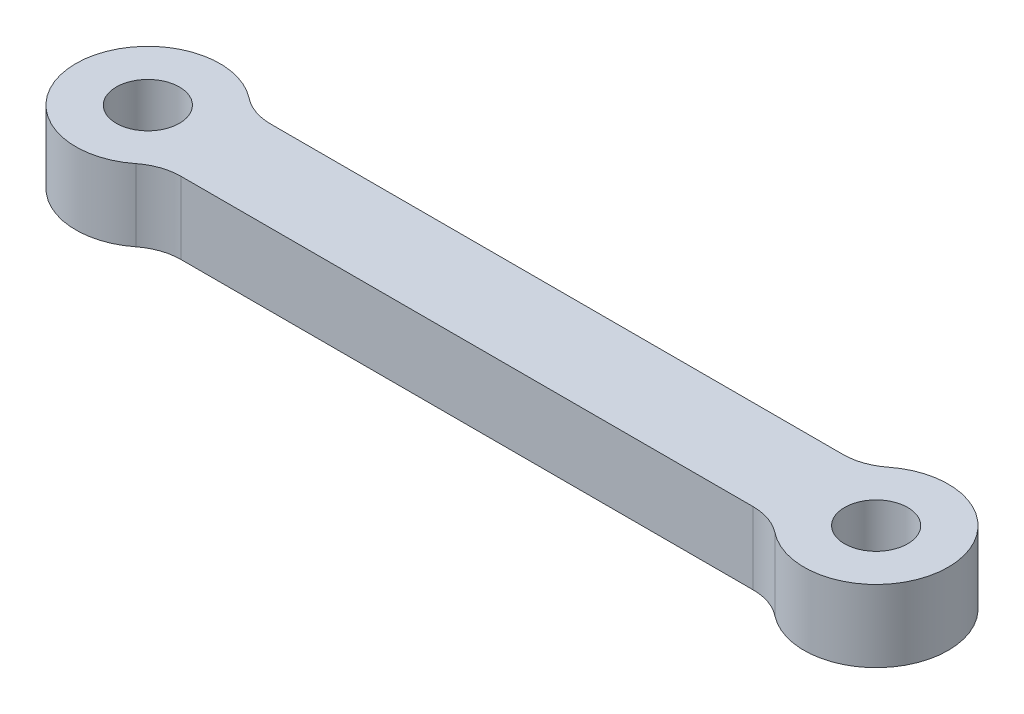
from build123d import *

# Parameters (mm, degrees)
SKETCH1_R           = 1.75
BOSS_EXTRUDE1_DEPTH = 4


with BuildPart() as part:
    # Sketch1 → Boss-Extrude1 (new body)
    with BuildSketch(Plane.XZ):
        with BuildLine():
            Line((36.07987298, 2.5), (4.330127019, 2.5))
            ThreePointArc((4.330127019, 2.5), (3.348146513, 2.665266452), (2.474358297, 3.142857143))
            ThreePointArc((2.474358297, 3.142857143), (-4, 0), (2.474358297, -3.142857143))
            ThreePointArc((2.474358297, -3.142857143), (3.348146513, -2.665266452), (4.330127019, -2.5))
            Line((4.330127019, -2.5), (36.07987298, -2.5))
            ThreePointArc((36.07987298, -2.5), (37.061853486, -2.665266452), (37.935641702, -3.142857143))
            ThreePointArc((37.935641702, -3.142857143), (44.409999999, 0), (37.935641702, 3.142857143))
            ThreePointArc((37.935641702, 3.142857143), (37.061853486, 2.665266452), (36.07987298, 2.5))
        make_face()
        with Locations(Location((40.409999999, 0, 0), (0, 0, 90))):
            Circle(SKETCH1_R, mode=Mode.SUBTRACT)
        with Locations(Location((0, 0, 0), (0, 0, 90))):
            Circle(SKETCH1_R, mode=Mode.SUBTRACT)
    extrude(amount=-BOSS_EXTRUDE1_DEPTH)


solid = part.part
